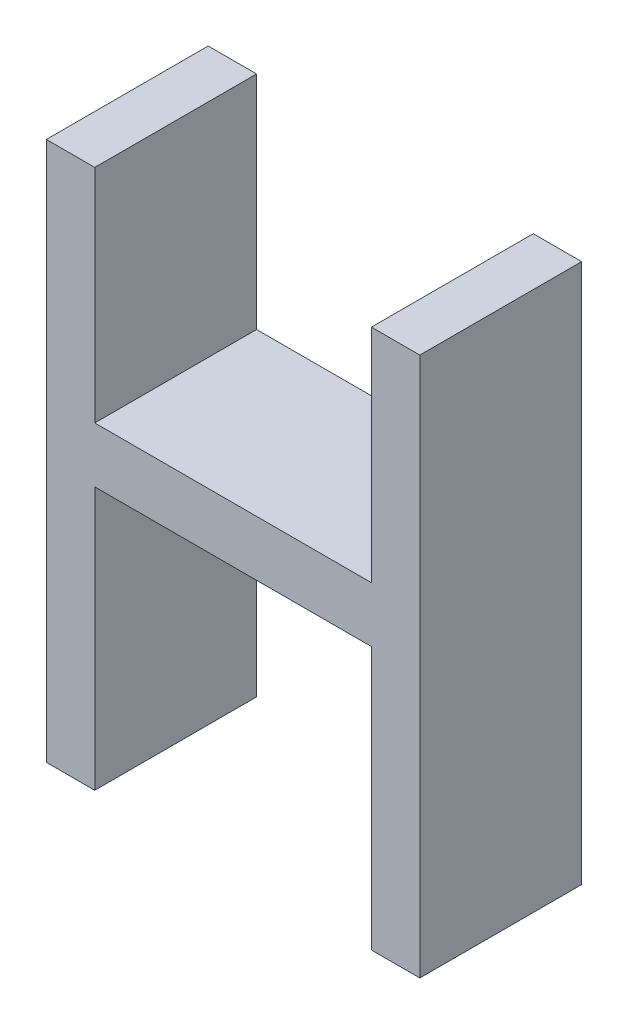
from build123d import *

# Parameters (mm, degrees)
BOSS_EXTRU_1_DEPTH = 1.5


with BuildPart() as part:
    # Esquisse1 → Boss.-Extru.1 (new body)
    with BuildSketch(Plane.XY):
        Polygon((-55.432465326, -17.870119076), (-54.983747377, -17.870119076), (-54.983747377, -19.921401128), (-52.419644813, -19.921401128), (-52.419644813, -17.870119076), (-51.970926864, -17.870119076), (-51.970926864, -22.870119076), (-52.419644813, -22.870119076), (-52.419644813, -20.43422164), (-54.983747377, -20.43422164), (-54.983747377, -22.870119076), (-55.432465326, -22.870119076), align=None)
    extrude(amount=BOSS_EXTRU_1_DEPTH)


solid = part.part
